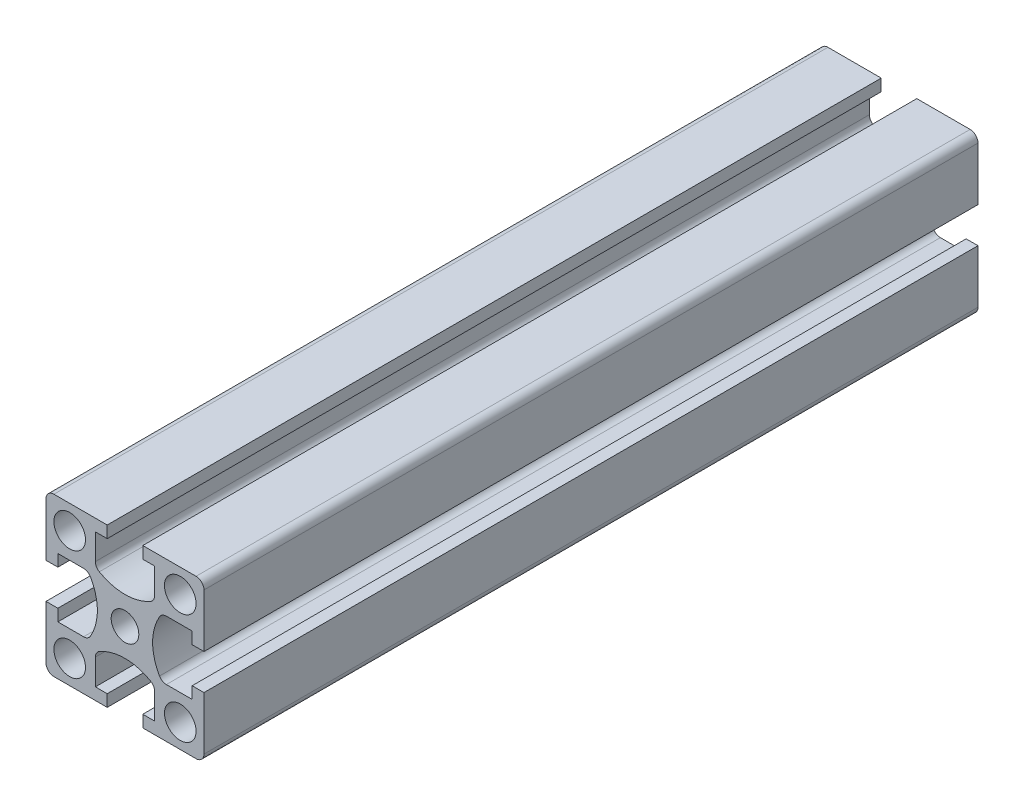
from build123d import *

# Parameters (mm, degrees)
SKETCH1_R           = 2
SKETCH1_R_2         = 1.75
BOSS_EXTRUDE1_DEPTH = 98


with BuildPart() as part:
    # Sketch1 → Boss-Extrude1 (new body)
    with BuildSketch(Plane.XY):
        with BuildLine():
            Line((-10, 9), (-10, 2.25))
            Line((-10, 2.25), (-8.5, 2.25))
            Line((-8.5, 2.25), (-8.5, 3.75))
            Line((-8.5, 3.75), (-5.236860279, 3.75))
            ThreePointArc((-5.236860279, 3.75), (-4.736860279, 3.616025404), (-4.370834875, 3.25))
            ThreePointArc((-4.370834875, 3.25), (-3.5, 0), (-4.370834875, -3.25))
            ThreePointArc((-4.370834875, -3.25), (-4.736860279, -3.616025404), (-5.236860279, -3.75))
            Line((-5.236860279, -3.75), (-8.5, -3.75))
            Line((-8.5, -3.75), (-8.5, -2.25))
            Line((-8.5, -2.25), (-10, -2.25))
            Line((-10, -2.25), (-10, -9))
            ThreePointArc((-10, -9), (-9.707106781, -9.707106781), (-9, -10))
            Line((-9, -10), (-2.25, -10))
            Line((-2.25, -10), (-2.25, -8.5))
            Line((-2.25, -8.5), (-3.75, -8.5))
            Line((-3.75, -8.5), (-3.75, -5.236860279))
            ThreePointArc((-3.75, -5.236860279), (-3.616025404, -4.736860279), (-3.25, -4.370834875))
            ThreePointArc((-3.25, -4.370834875), (0, -3.5), (3.25, -4.370834875))
            ThreePointArc((3.25, -4.370834875), (3.616025404, -4.736860279), (3.75, -5.236860279))
            Line((3.75, -5.236860279), (3.75, -8.5))
            Line((3.75, -8.5), (2.25, -8.5))
            Line((2.25, -8.5), (2.25, -10))
            Line((2.25, -10), (9, -10))
            ThreePointArc((9, -10), (9.707106781, -9.707106781), (10, -9))
            Line((10, -9), (10, -2.25))
            Line((10, -2.25), (8.5, -2.25))
            Line((8.5, -2.25), (8.5, -3.75))
            Line((8.5, -3.75), (5.236860279, -3.75))
            ThreePointArc((5.236860279, -3.75), (4.736860279, -3.616025404), (4.370834875, -3.25))
            ThreePointArc((4.370834875, -3.25), (3.5, 0), (4.370834875, 3.25))
            ThreePointArc((4.370834875, 3.25), (4.736860279, 3.616025404), (5.236860279, 3.75))
            Line((5.236860279, 3.75), (8.5, 3.75))
            Line((8.5, 3.75), (8.5, 2.25))
            Line((8.5, 2.25), (10, 2.25))
            Line((10, 2.25), (10, 9))
            ThreePointArc((10, 9), (9.707106781, 9.707106781), (9, 10))
            Line((9, 10), (2.25, 10))
            Line((2.25, 10), (2.25, 8.5))
            Line((2.25, 8.5), (3.75, 8.5))
            Line((3.75, 8.5), (3.75, 5.236860279))
            ThreePointArc((3.75, 5.236860279), (3.616025404, 4.736860279), (3.25, 4.370834875))
            ThreePointArc((3.25, 4.370834875), (0, 3.5), (-3.25, 4.370834875))
            ThreePointArc((-3.25, 4.370834875), (-3.616025404, 4.736860279), (-3.75, 5.236860279))
            Line((-3.75, 5.236860279), (-3.75, 8.5))
            Line((-3.75, 8.5), (-2.25, 8.5))
            Line((-2.25, 8.5), (-2.25, 10))
            Line((-2.25, 10), (-9, 10))
            ThreePointArc((-9, 10), (-9.707106781, 9.707106781), (-10, 9))
        make_face()
        with Locations((-7, -7)):
            Circle(SKETCH1_R, mode=Mode.SUBTRACT)
        with Locations((7, -7)):
            Circle(SKETCH1_R, mode=Mode.SUBTRACT)
        with Locations((7, 7)):
            Circle(SKETCH1_R, mode=Mode.SUBTRACT)
        Circle(SKETCH1_R_2, mode=Mode.SUBTRACT)
        with Locations((-7, 7)):
            Circle(SKETCH1_R, mode=Mode.SUBTRACT)
    extrude(amount=BOSS_EXTRUDE1_DEPTH)


solid = part.part
